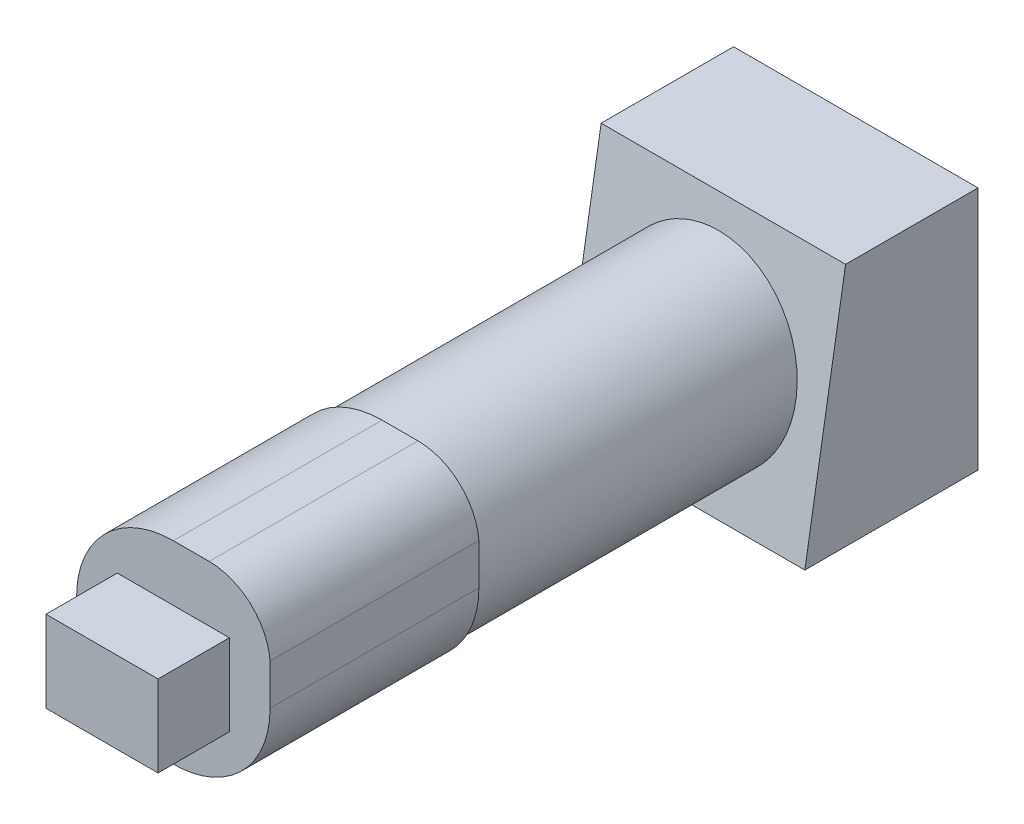
from build123d import *

# Parameters (mm, degrees)
CROQUIS1_W              = 24
CROQUIS1_H              = 17
SALIENTE_EXTRUIR1_DEPTH = 24
CORTAR_EXTRUIR1_DEPTH   = 24
CROQUIS4_R              = 9.125
SALIENTE_EXTRUIR3_DEPTH = 33.5
SALIENTE_EXTRUIR4_DEPTH = 20.5
CROQUIS6_W              = 11
CROQUIS6_H              = 8
SALIENTE_EXTRUIR5_DEPTH = 7
CROQUIS7_R              = 2.05
CORTAR_EXTRUIR2_DEPTH   = 6


with BuildPart() as part:
    # Croquis1 → Saliente-Extruir1 (new body)
    with BuildSketch(Plane(origin=(0, 0, 0), x_dir=(1, 0, 0), z_dir=(0, 1, 0))):
        Rectangle(CROQUIS1_W, CROQUIS1_H)
    extrude(amount=SALIENTE_EXTRUIR1_DEPTH)

    # Croquis2 → Cortar-Extruir1 (cut)
    with BuildSketch(Plane(origin=(12, 0, 0), x_dir=(0, 0, -1), z_dir=(1, 0, 0))):
        Polygon((-8.5, 0), (-4.500138715, 24), (-8.5, 24), align=None)
    extrude(amount=-CORTAR_EXTRUIR1_DEPTH, mode=Mode.SUBTRACT)

    # Croquis4 → Saliente-Extruir3 (add)
    with BuildSketch(Plane(origin=(0, 0, 4.500138715), x_dir=(1, 0, 0), z_dir=(0, 0, -1))):
        with Locations(Location((0, -12, 0), (0, 0, 180))):
            Circle(CROQUIS4_R)
    extrude(amount=-SALIENTE_EXTRUIR3_DEPTH)

    # Croquis5 → Saliente-Extruir4 (add)
    with BuildSketch(Plane.XY.offset(38.000138715)):
        with BuildLine():
            Line((0, 21.5), (3.522837546, 21.5))
            ThreePointArc((3.522837546, 21.5), (7.576354538, 19.923686246), (9.5, 16.023))
            Line((9.5, 16.023), (9.5, 12))
            ThreePointArc((9.5, 12), (-6.717514421, 5.282485579), (0, 21.5))
        make_face()
    extrude(amount=SALIENTE_EXTRUIR4_DEPTH)

    # Croquis6 → Saliente-Extruir5 (add)
    with BuildSketch(Plane.XY.offset(58.500138715)):
        with Locations((0, 12)):
            Rectangle(CROQUIS6_W, CROQUIS6_H)
    extrude(amount=SALIENTE_EXTRUIR5_DEPTH)

    # Croquis7 → Cortar-Extruir2 (cut)
    with BuildSketch(Plane.XZ):
        with Locations(Location((-5, 3.5, 0), (0, 0, 270))):
            Circle(CROQUIS7_R)
        with Locations(Location((5, 3.5, 0), (0, 0, 270))):
            Circle(CROQUIS7_R)
    extrude(amount=-CORTAR_EXTRUIR2_DEPTH, mode=Mode.SUBTRACT)


solid = part.part
